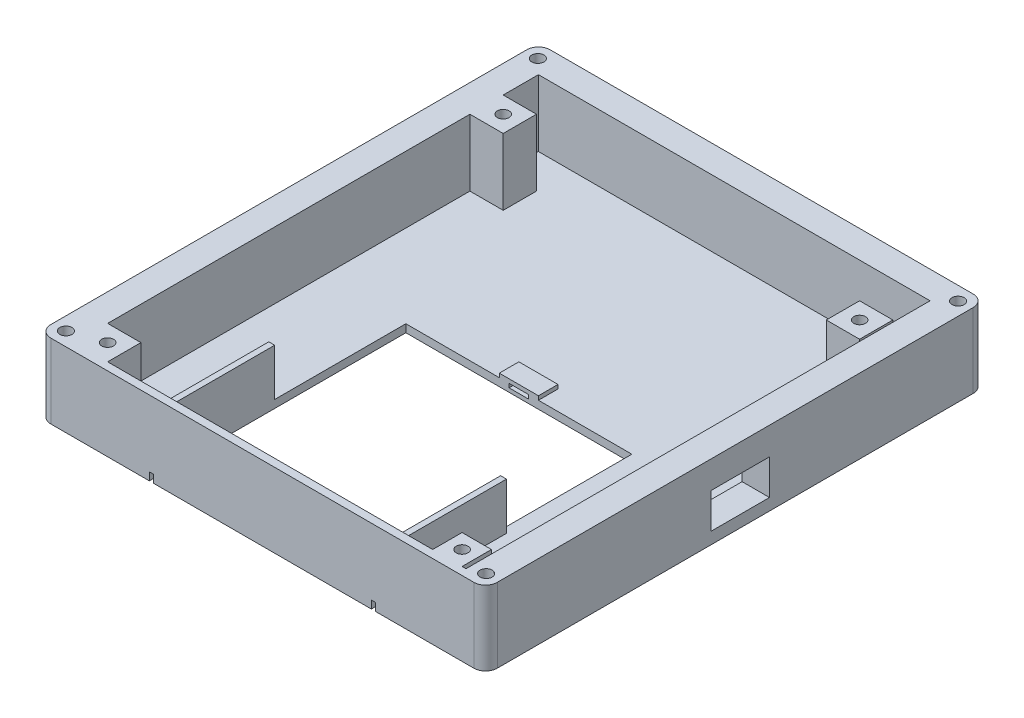
from build123d import *

# Parameters (mm, degrees)
SALIENTE_EXTRUIR4_DEPTH  = 2
SALIENTE_EXTRUIR6_DEPTH  = 120.5
CROQUIS8_W               = 104
CROQUIS8_H               = 122.5
SALIENTE_EXTRUIR7_DEPTH  = 2
CROQUIS9_W               = 100
CROQUIS9_H               = 17
SALIENTE_EXTRUIR8_DEPTH  = 2
CROQUIS13_W              = 8.5
CROQUIS13_H              = 8.5
CROQUIS13_R              = 1.5
CROQUIS13_W_2            = 7.5
CROQUIS13_H_2            = 7.5
SALIENTE_EXTRUIR9_DEPTH  = 17
CROQUIS14_W              = 5
CROQUIS14_H              = 28
SALIENTE_EXTRUIR10_DEPTH = 122.5
CROQUIS15_W              = 5
CROQUIS15_H              = 28
SALIENTE_EXTRUIR11_DEPTH = 114
REDONDEO1_R              = 3
CORTAR_EXTRUIR1_REACH    = 153.514
CROQUIS17_W              = 5
CROQUIS17_H              = 9
CORTAR_EXTRUIR2_REACH    = 173.992
CROQUIS18_W              = 5
CROQUIS18_H              = 9
CROQUIS19_R              = 1.55
CORTAR_EXTRUIR3_DEPTH    = 11
CROQUIS20_W              = 57.7
CROQUIS20_H              = 63.5
CORTAR_EXTRUIR4_DEPTH    = 152.514025753
CROQUIS22_W              = 1.5
CROQUIS22_H              = 12
SALIENTE_EXTRUIR12_DEPTH = 30
CROQUIS26_W              = 10
CROQUIS26_H              = 5
SALIENTE_EXTRUIR14_DEPTH = 1
CROQUIS27_W              = 5
CROQUIS27_H              = 1
CORTAR_EXTRUIR8_DEPTH    = 3
CROQUIS28_W              = 1
CROQUIS28_H              = 2
CORTAR_EXTRUIR9_DEPTH    = 10
CROQUIS29_W              = 102
CROQUIS29_H              = 7.5
CORTAR_EXTRUIR11_DEPTH   = 125.5
CROQUIS30_W              = 102
CROQUIS30_H              = 19
CORTAR_EXTRUIR12_DEPTH   = 152.514025753
CROQUIS31_W              = 15
CROQUIS31_H              = 9
CORTAR_EXTRUIR13_DEPTH   = 10


with BuildPart() as part:
    # Croquis5 → Saliente-Extruir4 (new body)
    with BuildSketch(Plane.XY):
        Polygon((0, 0), (39, 0), (39, -10), (66.5, -10), (66.5, -19), (67.5, -19), (67.5, -36), (-36.5, -36), (-36.5, -19), (-35.5, -19), (-35.5, -10), (0, -10), align=None)
    extrude(amount=-SALIENTE_EXTRUIR4_DEPTH)

    # Croquis7 → Saliente-Extruir6 (add)
    with BuildSketch(Plane(origin=(0, 0, -2), x_dir=(-1, 0, 0), z_dir=(0, 0, -1))):
        Polygon((-67.5, -36), (-65.5, -36), (-65.5, -11.5), (-66.5, -11.5), (-66.5, -19), (-67.5, -19), align=None)
        Polygon((36.5, -36), (34.5, -36), (34.5, -11.5), (35.5, -11.5), (35.5, -19), (36.5, -19), align=None)
    extrude(amount=SALIENTE_EXTRUIR6_DEPTH)

    # Croquis8 → Saliente-Extruir7 (add)
    with BuildSketch(Plane.XZ.offset(36)):
        with Locations((15.5, -61.25)):
            Rectangle(CROQUIS8_W, CROQUIS8_H)
    extrude(amount=SALIENTE_EXTRUIR7_DEPTH)

    # Croquis9 → Saliente-Extruir8 (add)
    with BuildSketch(Plane(origin=(0, 0, -122.5), x_dir=(-1, 0, 0), z_dir=(0, 0, -1))):
        with Locations((-15.5, -27.5)):
            Rectangle(CROQUIS9_W, CROQUIS9_H)
    extrude(amount=-SALIENTE_EXTRUIR8_DEPTH)

    # Croquis13 → Saliente-Extruir9 (add)
    # profile 1 of 4: a face of its own
    with BuildSketch(Plane(origin=(0, -36, 0), x_dir=(1, 0, 0), z_dir=(0, 1, 0))):
        with Locations((-30.25, 6.25)):
            Rectangle(CROQUIS13_W, CROQUIS13_H)
        with Locations(Location((-30.25, 6.25, 0), (0, 0, 90))):
            Circle(CROQUIS13_R, mode=Mode.SUBTRACT)
    # profile 2 of 4: a face of its own
    with BuildSketch(Plane(origin=(0, -36, 0), x_dir=(1, 0, 0), z_dir=(0, 1, 0))):
        with Locations((-30.25, 107.25)):
            Rectangle(CROQUIS13_W, CROQUIS13_H)
        with Locations(Location((-30.25, 107.25, 0), (0, 0, 90))):
            Circle(CROQUIS13_R, mode=Mode.SUBTRACT)
    # profile 3 of 4: a face of its own
    with BuildSketch(Plane(origin=(0, -36, 0), x_dir=(1, 0, 0), z_dir=(0, 1, 0))):
        with Locations((60.75, 107.25)):
            Rectangle(CROQUIS13_W, CROQUIS13_H)
        with Locations(Location((60.75, 107.25, 0), (0, 0, 90))):
            Circle(CROQUIS13_R, mode=Mode.SUBTRACT)
    # profile 4 of 4: a face of its own
    with BuildSketch(Plane(origin=(0, -36, 0), x_dir=(1, 0, 0), z_dir=(0, 1, 0))):
        with Locations((60.75, 5.75)):
            Rectangle(CROQUIS13_W_2, CROQUIS13_H_2)
        with Locations(Location((60.75, 5.75, 0), (0, 0, 90))):
            Circle(CROQUIS13_R, mode=Mode.SUBTRACT)
    extrude(amount=SALIENTE_EXTRUIR9_DEPTH)

    # Croquis14 → Saliente-Extruir10 (add)
    with BuildSketch(Plane.XY):
        with Locations((-39, -24)):
            Rectangle(CROQUIS14_W, CROQUIS14_H)
        with Locations((70, -24)):
            Rectangle(CROQUIS14_W, CROQUIS14_H)
    extrude(amount=-SALIENTE_EXTRUIR10_DEPTH)

    # Croquis15 → Saliente-Extruir11 (add)
    with BuildSketch(Plane.ZY.offset(41.5)):
        with Locations((-125, -24)):
            Rectangle(CROQUIS15_W, CROQUIS15_H)
    extrude(amount=-SALIENTE_EXTRUIR11_DEPTH)

    # Redondeo1
    redondeo1_edges = [part.edges().sort_by_distance(p)[0] for p in [
        (-41.5, -24, 0),
        (72.5, -24, 0),
        (-41.5, -24, -127.5),
        (72.5, -24, -127.5),
    ]]
    fillet(redondeo1_edges, radius=REDONDEO1_R)

    # Croquis17 → Cortar-Extruir1 (cut, up to next)
    with BuildSketch(Plane.XY, mode=Mode.PRIVATE) as cortar_extruir1_sk1:
        with Locations((-39, -14.5)):
            Rectangle(CROQUIS17_W, CROQUIS17_H)
    cortar_extruir1_tool1 = extrude(cortar_extruir1_sk1.sketch, amount=-CORTAR_EXTRUIR1_REACH, mode=Mode.PRIVATE) & part.part
    # Croquis17 → Cortar-Extruir1 (cut, up to next)
    with BuildSketch(Plane.XY, mode=Mode.PRIVATE) as cortar_extruir1_sk2:
        with Locations((70, -14.5)):
            Rectangle(CROQUIS17_W, CROQUIS17_H)
    cortar_extruir1_tool2 = extrude(cortar_extruir1_sk2.sketch, amount=-CORTAR_EXTRUIR1_REACH, mode=Mode.PRIVATE) & part.part
    add(cortar_extruir1_tool1.solids().sort_by_distance((-39, -14.5, 0))[0], mode=Mode.SUBTRACT)
    add(cortar_extruir1_tool2.solids().sort_by_distance((70, -14.5, 0))[0], mode=Mode.SUBTRACT)

    # Croquis18 → Cortar-Extruir2 (cut, up to next)
    with BuildSketch(Plane(origin=(67.5, 0, 0), x_dir=(0, 0, -1), z_dir=(1, 0, 0)), mode=Mode.PRIVATE) as cortar_extruir2_sk1:
        with Locations((125, -14.5)):
            Rectangle(CROQUIS18_W, CROQUIS18_H)
    cortar_extruir2_tool1 = extrude(cortar_extruir2_sk1.sketch, amount=-CORTAR_EXTRUIR2_REACH, mode=Mode.PRIVATE) & part.part
    add(cortar_extruir2_tool1.solids().sort_by_distance((67.5, -14.5, -125))[0], mode=Mode.SUBTRACT)

    # Croquis19 → Cortar-Extruir3 (cut)
    with BuildSketch(Plane(origin=(0, -19, 0), x_dir=(1, 0, 0), z_dir=(0, 1, 0))):
        with Locations(Location((-38.15, 124, 0), (0, 0, 270))):
            Circle(CROQUIS19_R)
        with Locations(Location((69.15, 124, 0), (0, 0, 270))):
            Circle(CROQUIS19_R)
        with Locations(Location((-38.15, 3.5, 0), (0, 0, 270))):
            Circle(CROQUIS19_R)
        with Locations(Location((69.15, 3.5, 0), (0, 0, 270))):
            Circle(CROQUIS19_R)
    extrude(amount=-CORTAR_EXTRUIR3_DEPTH, mode=Mode.SUBTRACT)

    # Croquis20 → Cortar-Extruir4 (cut, through all)
    with BuildSketch(Plane.XZ.offset(38)):
        with Locations((15.5, -33.75)):
            Rectangle(CROQUIS20_W, CROQUIS20_H)
    extrude(amount=-CORTAR_EXTRUIR4_DEPTH, mode=Mode.SUBTRACT)

    # Croquis22 → Saliente-Extruir12 (add)
    with BuildSketch(Plane(origin=(0, 0, -2), x_dir=(-1, 0, 0), z_dir=(0, 0, -1))):
        with Locations((-45.1, -30)):
            Rectangle(CROQUIS22_W, CROQUIS22_H)
        with Locations((14.1, -30)):
            Rectangle(CROQUIS22_W, CROQUIS22_H)
    extrude(amount=SALIENTE_EXTRUIR12_DEPTH)

    # Croquis26 → Saliente-Extruir14 (add)
    with BuildSketch(Plane(origin=(0, -36, 0), x_dir=(1, 0, 0), z_dir=(0, 1, 0))):
        with Locations((15.5, 68)):
            Rectangle(CROQUIS26_W, CROQUIS26_H)
    extrude(amount=SALIENTE_EXTRUIR14_DEPTH)

    # Croquis27 → Cortar-Extruir8 (cut)
    with BuildSketch(Plane.XY.offset(-65.5)):
        with Locations((15.5, -36.5)):
            Rectangle(CROQUIS27_W, CROQUIS27_H)
    extrude(amount=-CORTAR_EXTRUIR8_DEPTH, mode=Mode.SUBTRACT)

    # Croquis28 → Cortar-Extruir9 (cut)
    with BuildSketch(Plane.XY):
        with Locations((43.85, -37)):
            Rectangle(CROQUIS28_W, CROQUIS28_H)
        with Locations((-12.85, -37)):
            Rectangle(CROQUIS28_W, CROQUIS28_H)
    extrude(amount=-CORTAR_EXTRUIR9_DEPTH, mode=Mode.SUBTRACT)

    # Croquis29 → Cortar-Extruir11 (cut)
    with BuildSketch(Plane(origin=(0, 0, -127.5), x_dir=(-1, 0, 0), z_dir=(0, 0, -1))):
        with Locations((-15.5, -15.25)):
            Rectangle(CROQUIS29_W, CROQUIS29_H)
    extrude(amount=-CORTAR_EXTRUIR11_DEPTH, mode=Mode.SUBTRACT)

    # Croquis30 → Cortar-Extruir12 (cut, through all)
    with BuildSketch(Plane.XY):
        with Locations((15.5, -9.5)):
            Rectangle(CROQUIS30_W, CROQUIS30_H)
    extrude(amount=-CORTAR_EXTRUIR12_DEPTH, mode=Mode.SUBTRACT)

    # Croquis31 → Cortar-Extruir13 (cut)
    with BuildSketch(Plane(origin=(72.5, 0, 0), x_dir=(0, 0, -1), z_dir=(1, 0, 0))):
        with Locations((65, -30.5)):
            Rectangle(CROQUIS31_W, CROQUIS31_H)
    extrude(amount=-CORTAR_EXTRUIR13_DEPTH, mode=Mode.SUBTRACT)


solid = part.part
